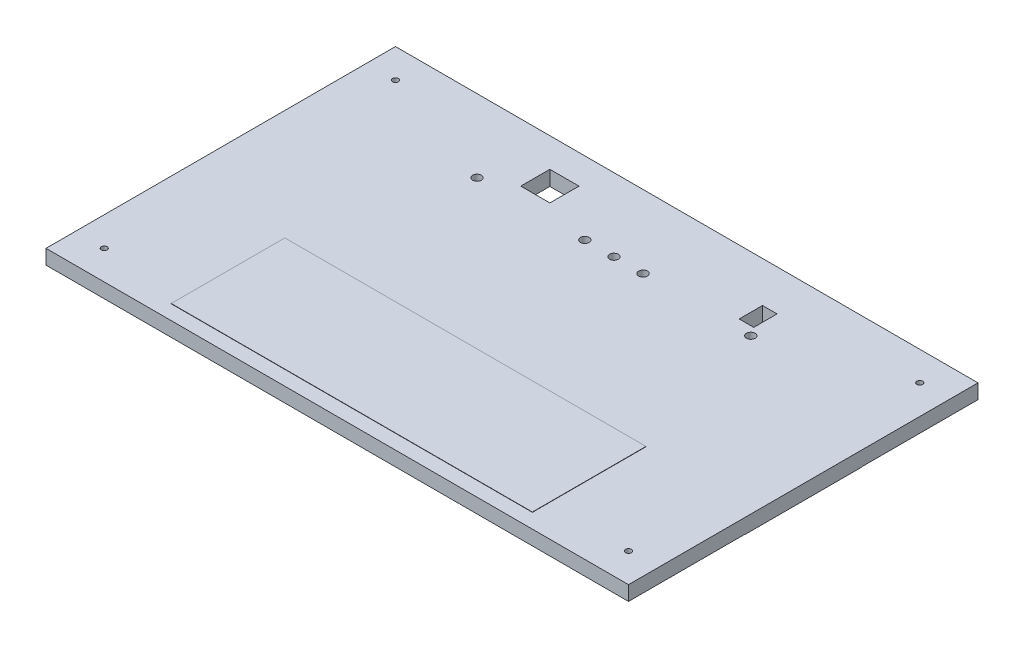
from build123d import *

# Parameters (mm, degrees)
SKETCH1_W           = 200
SKETCH1_H           = 120
BOSS_EXTRUDE1_DEPTH = 5
SKETCH2_R           = 1
CUT_EXTRUDE1_DEPTH  = 10
SKETCH3_W           = 27
SKETCH3_H           = 40
BOSS_EXTRUDE2_DEPTH = 0.1
SKETCH4_W           = 100
SKETCH4_H           = 28
BOSS_EXTRUDE3_DEPTH = 0.1
SKETCH5_R           = 1.5
SKETCH5_W           = 5
SKETCH5_H           = 8
SKETCH5_W_2         = 10
SKETCH5_H_2         = 10
CUT_EXTRUDE2_DEPTH  = 234.293827608
SKETCH6_W           = 124
SKETCH6_H           = 39
BOSS_EXTRUDE4_DEPTH = 0.1


with BuildPart() as part:
    # Sketch1 → Boss-Extrude1 (new body)
    with BuildSketch(Plane(origin=(0, 0, 0), x_dir=(1, 0, 0), z_dir=(0, 1, 0))):
        with Locations((100, 60)):
            Rectangle(SKETCH1_W, SKETCH1_H)
    extrude(amount=BOSS_EXTRUDE1_DEPTH)

    # Sketch2 → Cut-Extrude1 (cut)
    with BuildSketch(Plane(origin=(0, 5, 0), x_dir=(1, 0, 0), z_dir=(0, 1, 0))):
        with Locations(Location((10, 110, 0), (0, 0, 270))):
            Circle(SKETCH2_R)
        with Locations(Location((190, 110, 0), (0, 0, 90))):
            Circle(SKETCH2_R)
        with Locations(Location((190, 10, 0), (0, 0, 270))):
            Circle(SKETCH2_R)
        with Locations(Location((10, 10, 0), (0, 0, 90))):
            Circle(SKETCH2_R)
    extrude(amount=-CUT_EXTRUDE1_DEPTH, mode=Mode.SUBTRACT)

    # Sketch3 → Boss-Extrude2 (add)
    with BuildSketch(Plane.XZ):
        with Locations((13.5, -60)):
            Rectangle(SKETCH3_W, SKETCH3_H)
        with Locations((186.5, -60)):
            Rectangle(SKETCH3_W, SKETCH3_H)
    extrude(amount=BOSS_EXTRUDE2_DEPTH)

    # Sketch4 → Boss-Extrude3 (add)
    with BuildSketch(Plane.XZ):
        with Locations((100, -106)):
            Rectangle(SKETCH4_W, SKETCH4_H)
    extrude(amount=BOSS_EXTRUDE3_DEPTH)

    # Sketch5 → Cut-Extrude2 (cut, through all)
    with BuildSketch(Plane.XZ.offset(0.1)):
        with Locations(Location((53, -95, 0), (0, 0, 270))):
            Circle(SKETCH5_R)
        with Locations(Location((90, -95, 0), (0, 0, 270))):
            Circle(SKETCH5_R)
        with Locations(Location((100, -95, 0), (0, 0, 270))):
            Circle(SKETCH5_R)
        with Locations(Location((110, -95, 0), (0, 0, 270))):
            Circle(SKETCH5_R)
        with Locations(Location((147, -95, 0), (0, 0, 270))):
            Circle(SKETCH5_R)
        with Locations((142.5, -102)):
            Rectangle(SKETCH5_W, SKETCH5_H)
        with Locations((68, -105)):
            Rectangle(SKETCH5_W_2, SKETCH5_H_2)
    extrude(amount=-CUT_EXTRUDE2_DEPTH, mode=Mode.SUBTRACT)

    # Sketch6 → Boss-Extrude4 (add)
    with BuildSketch(Plane(origin=(0, 5, 0), x_dir=(1, 0, 0), z_dir=(0, 1, 0))):
        with Locations((100, 24.5)):
            Rectangle(SKETCH6_W, SKETCH6_H)
    extrude(amount=BOSS_EXTRUDE4_DEPTH)


solid = part.part
